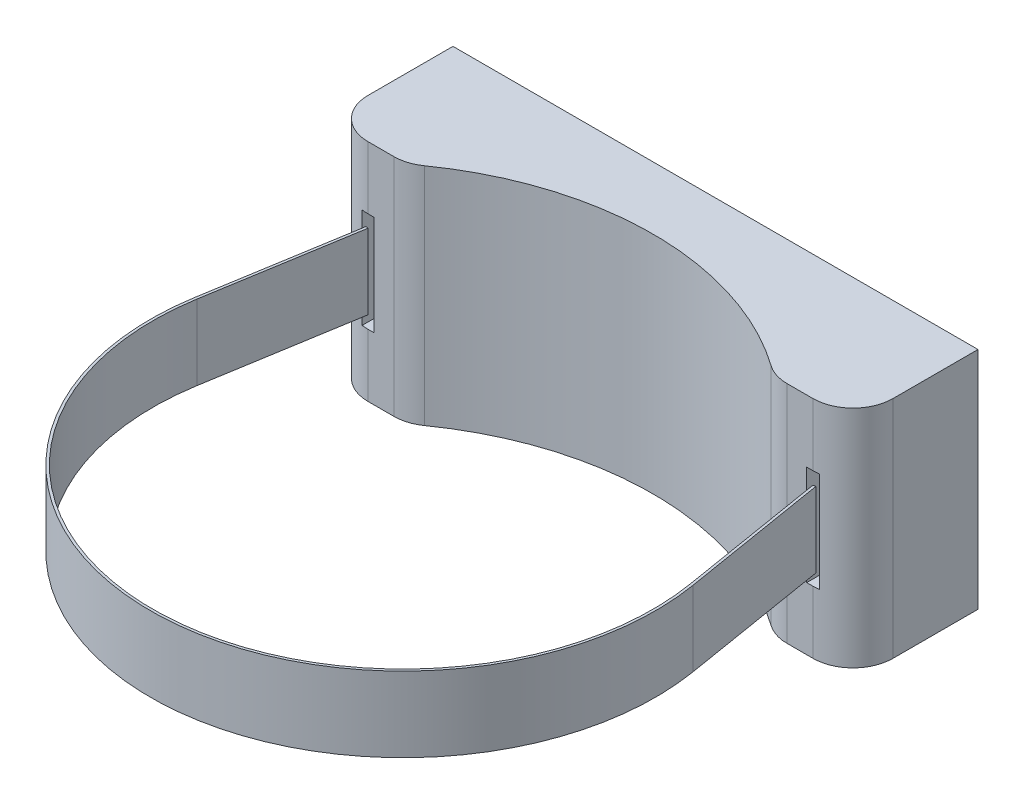
from build123d import *

# Parameters (mm, degrees)
BOSS_EXTRUDE1_DEPTH = 114.3
FILLET1_R           = 20.32
FILLET2_R           = 20.32
SKETCH2_W           = 6.35
SKETCH2_H           = 50.8
CUT_EXTRUDE1_DEPTH  = 187.759102857
EXTRUDE_THIN1_START = 6.35
EXTRUDE_THIN1_DEPTH = 38.1


with BuildPart() as part:
    # Sketch1 → Boss-Extrude1 (new body)
    with BuildSketch(Plane(origin=(0, 0, 0), x_dir=(1, 0, 0), z_dir=(0, 1, 0))):
        with BuildLine():
            Line((-133.35, 31.75), (133.35, 31.75))
            Line((133.35, 31.75), (133.35, -31.75))
            Line((133.35, -31.75), (93.109277196, -31.75))
            ThreePointArc((93.109277196, -31.75), (0, 0), (-93.109277196, -31.75))
            Line((-93.109277196, -31.75), (-133.35, -31.75))
            Line((-133.35, -31.75), (-133.35, 31.75))
        make_face()
    extrude(amount=BOSS_EXTRUDE1_DEPTH)

    # Fillet1
    fillet1_edges = [part.edges().sort_by_distance(p)[0] for p in [
        (-133.35, 57.15, 31.75),
        (133.35, 57.15, 31.75),
    ]]
    fillet(fillet1_edges, radius=FILLET1_R)

    # Fillet2
    fillet2_edges = [part.edges().sort_by_distance(p)[0] for p in [
        (93.109277196, 57.15, 31.75),
        (-93.109277196, 57.15, 31.75),
    ]]
    fillet(fillet2_edges, radius=FILLET2_R)

    # Sketch2 → Cut-Extrude1 (cut, through all)
    with BuildSketch(Plane.XY.offset(31.75)):
        with Locations((-113.03, 57.15)):
            Rectangle(SKETCH2_W, SKETCH2_H)
        with Locations((113.03, 57.15)):
            Rectangle(SKETCH2_W, SKETCH2_H)
    extrude(amount=-CUT_EXTRUDE1_DEPTH, mode=Mode.SUBTRACT)


with BuildPart() as body_2:
    # Sketch3 → Extrude-Thin1 (new body)
    with BuildSketch(Plane(origin=(0, 31.75, 0), x_dir=(1, 0, 0), z_dir=(0, 1, 0)).offset(EXTRUDE_THIN1_START)):
        with BuildLine():
            Line((-113.03, -31.75), (-125.313565249, -106.372097429))
            ThreePointArc((-125.313565249, -106.372097429), (0, -254), (125.313565249, -106.372097429))
            Line((125.313565249, -106.372097429), (113.03, -31.75))
            Line((113.03, -31.75), (114.283135652, -31.543720974))
            Line((114.283135652, -31.543720974), (126.566700902, -106.165818404))
            ThreePointArc((126.566700902, -106.165818404), (0, -255.27), (-126.566700902, -106.165818404))
            Line((-126.566700902, -106.165818404), (-114.283135652, -31.543720974))
            Line((-114.283135652, -31.543720974), (-113.03, -31.75))
        make_face()
    extrude(amount=EXTRUDE_THIN1_DEPTH)


solid = Compound([part.part, body_2.part])
